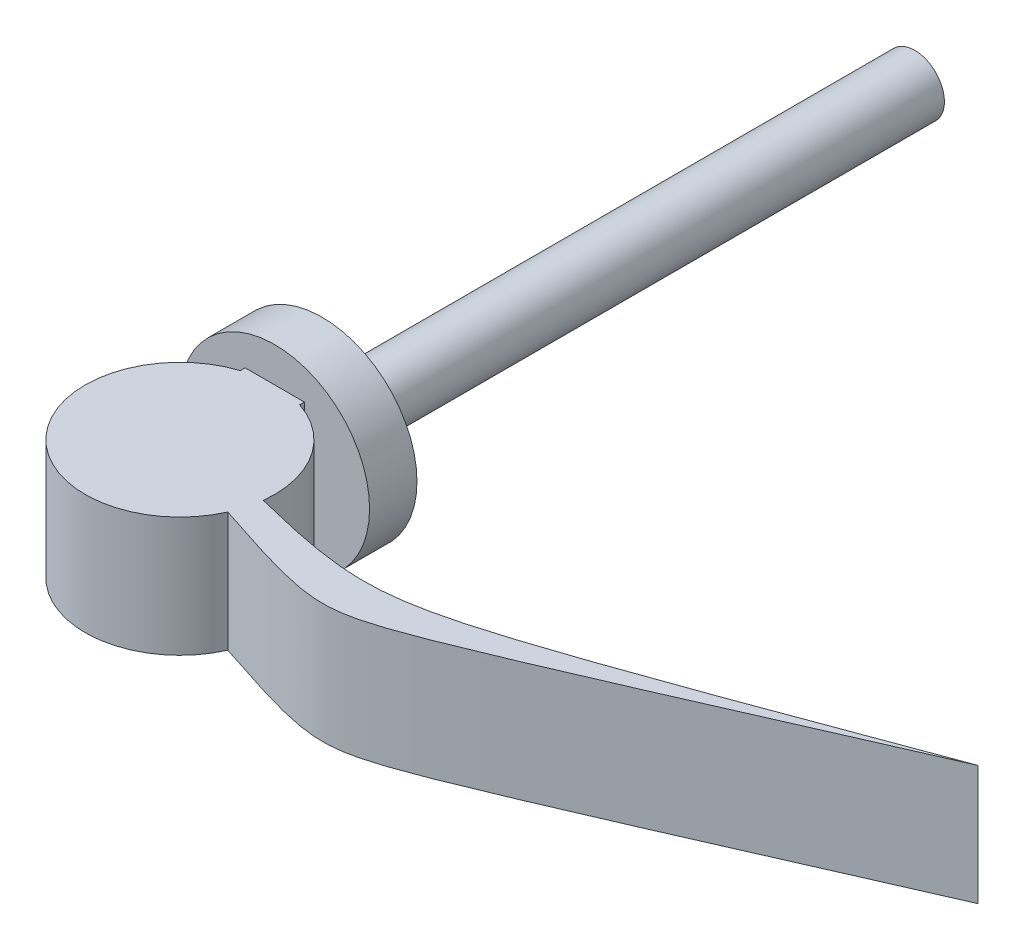
from build123d import *

# Parameters (mm, degrees)
SCHIZZO1_R                 = 2.5
GAMBOVITE_DEPTH            = 50
SCHIZZO2_R                 = 8
PIATTELLO_DEPTH            = 4
AGGANCIOLEVETTA_DEPTH      = 5.05
AGGANCIOLEVETTA_DEPTH_BACK = 5.05
LEVAPARTESINISTRA_DEPTH    = 10.1


with BuildPart() as part:
    # Schizzo1 → GamboVite (new body)
    with BuildSketch(Plane.XY):
        Circle(SCHIZZO1_R)
    extrude(amount=GAMBOVITE_DEPTH)

    # Schizzo2 → Piattello (add)
    with BuildSketch(Plane.XY.offset(50)):
        Circle(SCHIZZO2_R)
    extrude(amount=PIATTELLO_DEPTH)

    # Schizzo3 → AggancioLevetta (add, two sides: drawn at the far end of the back side and taken through both)
    with BuildSketch(Plane(origin=(0, 0, 0), x_dir=(1, 0, 0), z_dir=(0, 1, 0)).offset(-AGGANCIOLEVETTA_DEPTH_BACK)):
        with BuildLine():
            Line((-2.5, -54), (2.5, -54))
            Line((2.5, -54), (2.5, -56))
            ThreePointArc((2.5, -56), (0, -68.5), (-2.5, -56))
            Line((-2.5, -56), (-2.5, -54))
        make_face()
    extrude(amount=AGGANCIOLEVETTA_DEPTH + AGGANCIOLEVETTA_DEPTH_BACK)

    # Schizzo4 → LevaParteSinistra (add)
    with BuildSketch(Plane(origin=(0, 5.05, 0), x_dir=(1, 0, 0), z_dir=(0, 1, 0))):
        with BuildLine():
            ThreePointArc((7.947312157, -62.916640319), (-7.715150447, -59.884236882), (7.30315406, -65.265568982))
            add(Edge.make_bspline(
                [(7.30315406, -65.265568982), (18.851643449, -69.132186066), (57.465572699, -52.132579546)],
                knots=[0, 0, 0, 1, 1, 1], degree=2, weights=[1, 5.510920106, 1]))
            add(Edge.make_bspline(
                [(7.947312157, -62.916640319), (20.184895525, -66.031820038), (57.465572699, -52.132579546)],
                knots=[0, 0, 0, 1, 1, 1], degree=2, weights=[1, 3.14938455, 1]))
        make_face()
    extrude(amount=-LEVAPARTESINISTRA_DEPTH)


solid = part.part
